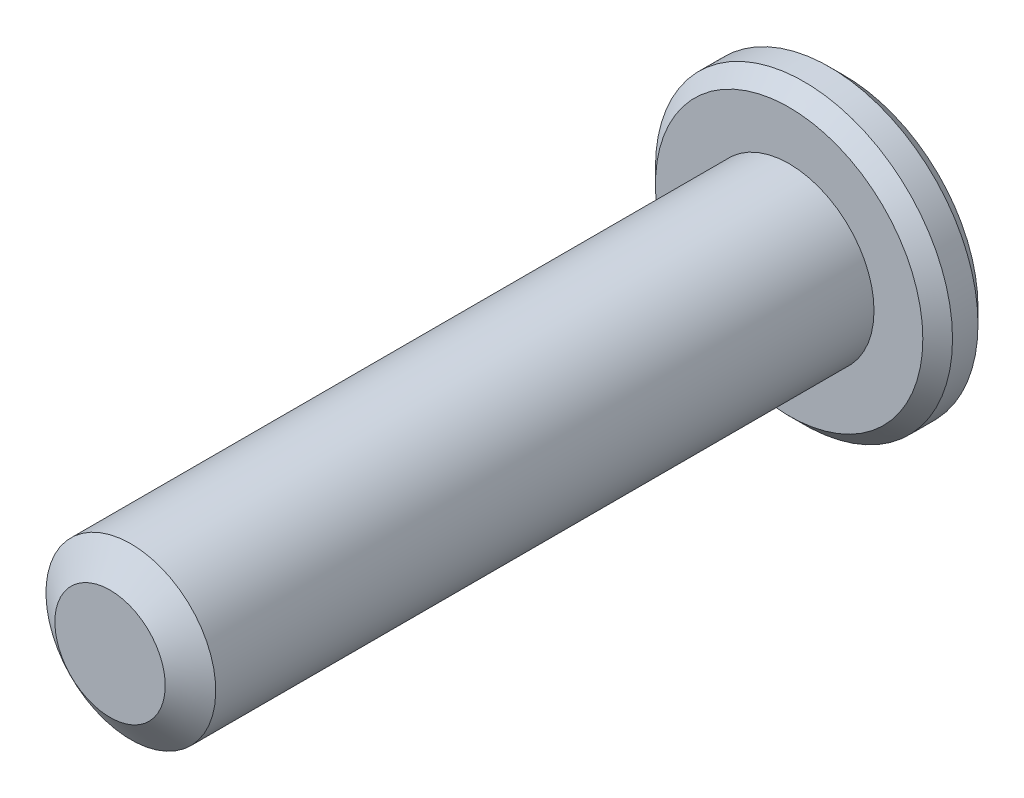
from build123d import *

# Parameters (mm, degrees)
SKETCH1_R          = 2
EXTRUDE1_DEPTH     = 17.3
SKETCH6_R          = 3.5
EXTRUDE2_DEPTH     = 1.3
CUT_EXTRUDE1_DEPTH = 0.975
SKETCH8_R          = 1.443375673
CUT_EXTRUDE2_DEPTH = 0.975
CUT_EXTRUDE2_TAPER = 45
CHAMFER1_SIZE      = 0.35


with BuildPart() as part:
    # Sketch1 → Extrude1 (new body)
    with BuildSketch(Plane.XY):
        Circle(SKETCH1_R)
    extrude(amount=EXTRUDE1_DEPTH)

    # Sketch4 → Cut-Revolve1 (revolve, cut)
    with BuildSketch(Plane(origin=(0, 0, 0), x_dir=(0, 0, -1), z_dir=(1, 0, 0))):
        Polygon((-16.809854723, 2), (-17.3, 1.3), (-17.3, 2), align=None)
    revolve(axis=Axis((0, 0, 0), (0, 0, 1)), mode=Mode.SUBTRACT)

    # Sketch6 → Extrude2 (add)
    with BuildSketch(Plane.XY):
        Circle(SKETCH6_R)
    extrude(amount=EXTRUDE2_DEPTH)

    # Sketch7 → Cut-Extrude1 (cut)
    with BuildSketch(Plane.XY):
        Polygon((0, 1.443375673), (-1.25, 0.721687836), (-1.25, -0.721687836), (0, -1.443375673), (1.25, -0.721687836), (1.25, 0.721687836), align=None)
    extrude(amount=CUT_EXTRUDE1_DEPTH, mode=Mode.SUBTRACT)

    # Sketch8 → Cut-Extrude2 (cut)
    with BuildSketch(Plane.XY):
        Circle(SKETCH8_R)
    extrude(amount=CUT_EXTRUDE2_DEPTH, taper=CUT_EXTRUDE2_TAPER, mode=Mode.SUBTRACT)

    # Chamfer1
    chamfer1_edges = [part.edges().sort_by_distance(p)[0] for p in [
        (-3.5, 0, 1.3),
        (-3.5, 0, 0),
    ]]
    chamfer(chamfer1_edges, length=CHAMFER1_SIZE)


solid = part.part
